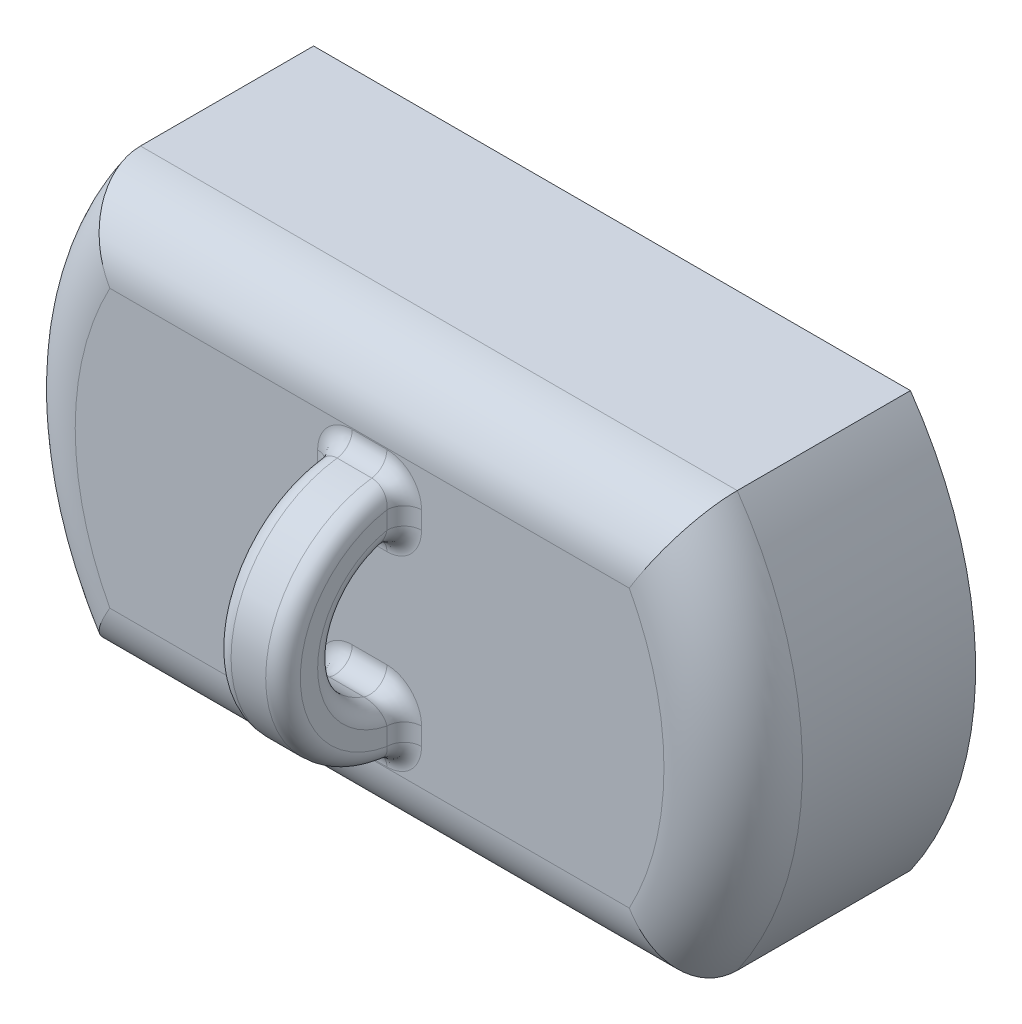
from build123d import *

# Parameters (mm, degrees)
BOSS_EXTRU_1_DEPTH      = 7
ESQUISSE2_W             = 5
ESQUISSE2_H             = 5
ENL_V_MAT_EXTRU_2_DEPTH = 5
CONG_1_R                = 2
BOSS_EXTRU_2_DEPTH      = 1
CONG_4_R                = 0.5


with BuildPart() as part:
    # Esquisse1 → Boss.-Extru.1 (new body)
    with BuildSketch(Plane.XY):
        with BuildLine():
            Line((-8.61684397, 6), (8.61684397, 6))
            ThreePointArc((8.61684397, 6), (10.5, 0), (8.61684397, -6))
            Line((8.61684397, -6), (-8.61684397, -6))
            ThreePointArc((-8.61684397, -6), (-10.5, 0), (-8.61684397, 6))
        make_face()
    extrude(amount=BOSS_EXTRU_1_DEPTH)

    # Esquisse2 → Enlèv. mat.-Extru.2 (cut)
    with BuildSketch(Plane.XY):
        with Locations((-6, 0)):
            Rectangle(ESQUISSE2_W, ESQUISSE2_H)
        with Locations((6, 0)):
            Rectangle(ESQUISSE2_W, ESQUISSE2_H)
    extrude(amount=ENL_V_MAT_EXTRU_2_DEPTH, mode=Mode.SUBTRACT)

    # Congé1
    cong_1_edges = [part.edges().sort_by_distance(p)[0] for p in [
        (10.5, 0, 7),
        (0, 6, 7),
        (-10.5, 0, 7),
        (0, -6, 7),
    ]]
    fillet(cong_1_edges, radius=CONG_1_R)

    # Esquisse3 → Boss.-Extru.2 (add, symmetric)
    with BuildSketch(Plane(origin=(0, 0, 0), x_dir=(0, 0, -1), z_dir=(1, 0, 0))):
        with BuildLine():
            Line((-7, -3.5), (-7, -2))
            ThreePointArc((-7, -2), (-9, 0), (-7, 2))
            Line((-7, 2), (-7, 3.5))
            ThreePointArc((-7, 3.5), (-10.5, 0), (-7, -3.5))
        make_face()
    extrude(amount=BOSS_EXTRU_2_DEPTH, both=True)

    # Congé4
    cong_4_edges = [part.edges().sort_by_distance(p)[0] for p in [
        (-1, 0, 9),
        (0, -2, 7),
        (-1, 2.75, 7),
        (0, 2, 7),
        (-1, 0, 10.5),
        (0, 3.5, 7),
        (-1, -2.75, 7),
        (0, -3.5, 7),
        (1, 0, 9),
        (1, 2.75, 7),
        (1, 0, 10.5),
        (1, -2.75, 7),
    ]]
    fillet(cong_4_edges, radius=CONG_4_R)


solid = part.part
